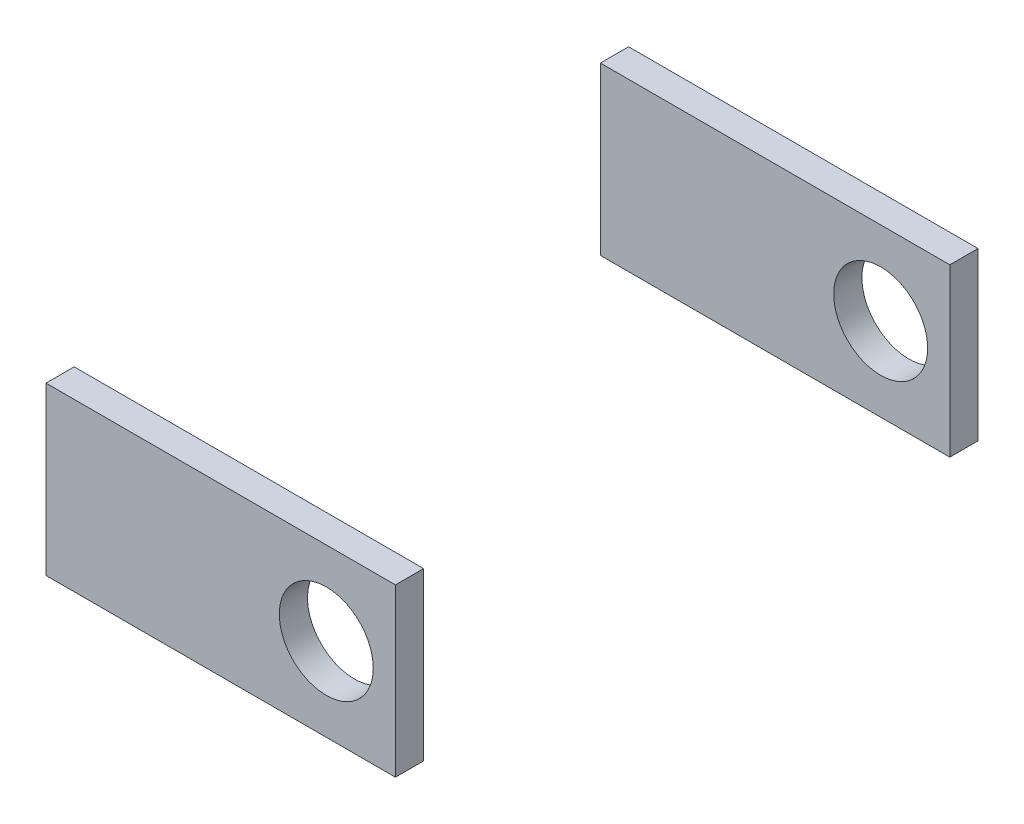
from build123d import *

# Parameters (mm, degrees)
SKETCH_1_R             = 2.5
EXTRUDE_1_DEPTH        = 88.2
SKETCH_2_R             = 12.5
EXTRUDE_2_DEPTH        = 62
SKETCH_3_W             = 40
SKETCH_3_H             = 17.730441408
SKETCH_3_R             = 5
EXTRUDE_3_DEPTH        = 3
PATTERN_LINEAR_1_COUNT = 2
PATTERN_LINEAR_1_PITCH = 59
SKETCH_5_R             = 2.5
CUT_EXTRUDE_2_DEPTH    = 85.347436238
SKETCH_6_R             = 2.5
CUT_EXTRUDE_3_DEPTH    = 88.2215119
SKETCH_7_W             = 56
SKETCH_7_H             = 17.730441408
CUT_EXTRUDE_4_DEPTH    = 83.581789618


with BuildPart() as part:
    # 草图1 → 凸台-拉伸1 (new body)
    with BuildSketch(Plane.XY):
        Circle(SKETCH_1_R)
    extrude(amount=EXTRUDE_1_DEPTH)

    # 草图2 → 凸台-拉伸2 (add)
    with BuildSketch(Plane.XY.offset(73.2)):
        Circle(SKETCH_2_R)
    extrude(amount=-EXTRUDE_2_DEPTH)

    # 草图3 → 凸台-拉伸3 (add)
    with BuildSketch(Plane.XY.offset(73.2)):
        with Locations((20, 0)):
            Rectangle(SKETCH_3_W, SKETCH_3_H)
        with Locations((32.640039451, 0)):
            Circle(SKETCH_3_R, mode=Mode.SUBTRACT)
    extrude_3 = extrude(amount=-EXTRUDE_3_DEPTH)

    # 阵列(线性)1: 凸台-拉伸3 ×2
    with Locations(*[(0, 0, -i * PATTERN_LINEAR_1_PITCH) for i in range(1, PATTERN_LINEAR_1_COUNT)]):
        add(extrude_3)

    # 草图5 → 切除-拉伸2 (cut, through all)
    # profile 1 of 2: a face of its own
    with BuildSketch(Plane.XY.offset(73.2)):
        with BuildLine():
            Line((2.812369821, -8.865220704), (2.812369821, 8.865220704))
            Line((2.812369821, 8.865220704), (8.812369821, 8.865220704))
            ThreePointArc((8.812369821, 8.865220704), (-12.5, 0), (8.812369821, -8.865220704))
            Line((8.812369821, -8.865220704), (2.812369821, -8.865220704))
        make_face()
        Circle(SKETCH_5_R, mode=Mode.SUBTRACT)
    # profile 2 of 2: a face of its own
    with BuildSketch(Plane.XY.offset(73.2)):
        Circle(SKETCH_5_R)
    extrude(amount=-CUT_EXTRUDE_2_DEPTH, mode=Mode.SUBTRACT)


with BuildPart() as cut_extrude_2_piece_1:
    # of the separate pieces the step leaves, piece 1, a body of its own (cut_extrude_2_pieces)
    add(part.part.solids().sort_by_distance((40, -8.865220704, 11.2))[0])

    # 草图7 → 切除-拉伸4 (cut, through all)
    with BuildSketch(Plane.ZY.offset(-2.812369821)):
        with Locations((42.2, 0)):
            Rectangle(SKETCH_7_W, SKETCH_7_H)
    extrude(amount=-CUT_EXTRUDE_4_DEPTH, mode=Mode.SUBTRACT)


with BuildPart() as cut_extrude_2_piece_2:
    # of the separate pieces the step leaves, piece 2, a body of its own (cut_extrude_2_pieces)
    add(part.part.solids().sort_by_distance((2.5, 0, 73.2))[0])

    # 草图6 → 切除-拉伸3 (cut, through all)
    with BuildSketch(Plane.XY.offset(88.2)):
        Circle(SKETCH_6_R)
    extrude(amount=-CUT_EXTRUDE_3_DEPTH, mode=Mode.SUBTRACT)


with BuildPart() as cut_extrude_4_piece_1:
    # of the separate pieces the step leaves, piece 1, a body of its own (cut_extrude_4_pieces)
    add(cut_extrude_2_piece_1.part.solids().sort_by_distance((2.812369821, 8.865220704, 73.2))[0])


with BuildPart() as cut_extrude_4_piece_2:
    # of the separate pieces the step leaves, piece 2, a body of its own (cut_extrude_4_pieces)
    add(cut_extrude_2_piece_1.part.solids().sort_by_distance((40, -8.865220704, 11.2))[0])


solid = Compound([cut_extrude_4_piece_1.part, cut_extrude_4_piece_2.part])
